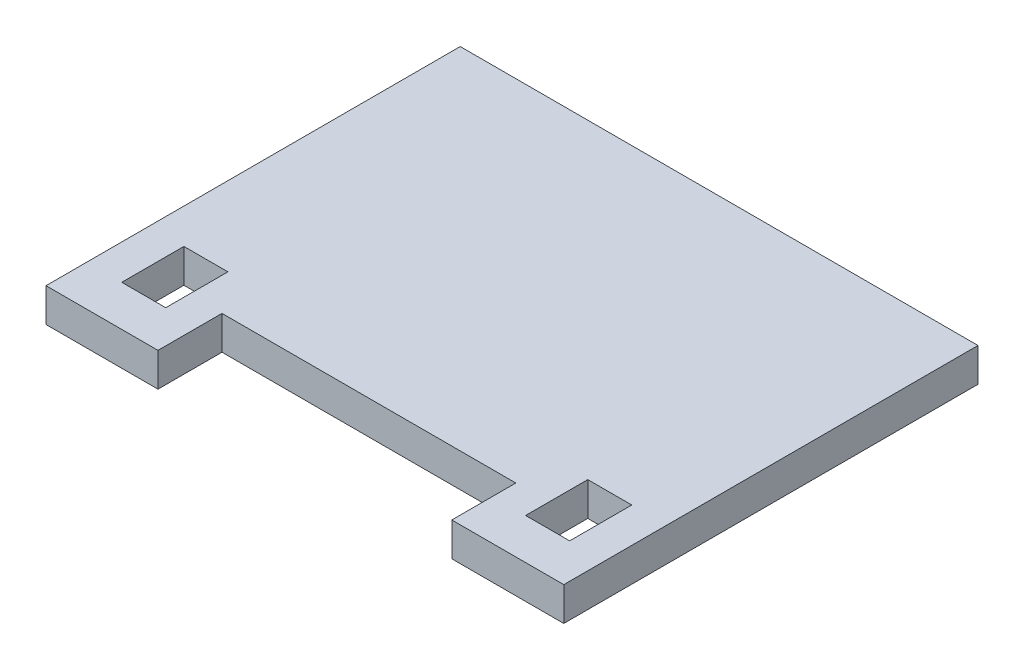
from build123d import *

# Parameters (mm, degrees)
SKETCH1_W           = 8.5
SKETCH1_H           = 12
BOSS_EXTRUDE1_DEPTH = 6.5


with BuildPart() as part:
    # Sketch1 → Boss-Extrude1 (new body)
    with BuildSketch(Plane(origin=(0, 0, 0), x_dir=(1, 0, 0), z_dir=(0, 1, 0))):
        Polygon((0, 80), (0, 0), (21.628337583, 0), (21.628337583, 12.362535516), (78.371662417, 12.362535516), (78.371662417, 0), (100, 0), (100, 80), align=None)
        with Locations((11, 13.880993548)):
            Rectangle(SKETCH1_W, SKETCH1_H, mode=Mode.SUBTRACT)
        with Locations((89, 13.880993548)):
            Rectangle(SKETCH1_W, SKETCH1_H, mode=Mode.SUBTRACT)
    extrude(amount=BOSS_EXTRUDE1_DEPTH)


solid = part.part
